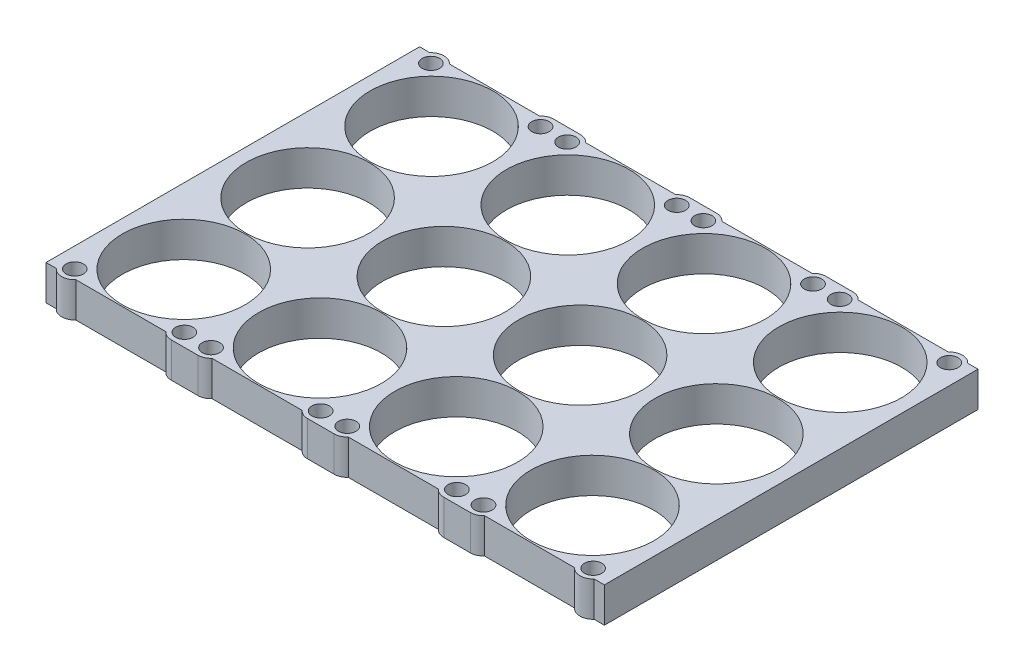
from build123d import *

# Parameters (mm, degrees)
SKETCH1_W           = 127.76
SKETCH1_H           = 85.48
SKETCH1_R           = 14.05
BOSS_EXTRUDE3_DEPTH = 8
BOSS_EXTRUDE4_DEPTH = 8
SKETCH4_R           = 1.1
CUT_EXTRUDE2_DEPTH  = 10
CUT_EXTRUDE3_START  = 8
SKETCH7_R           = 2
CUT_EXTRUDE3_DEPTH  = 3


with BuildPart() as part:
    # Sketch1 → Boss-Extrude3 (new body)
    with BuildSketch(Plane(origin=(0, 0, 0), x_dir=(1, 0, 0), z_dir=(0, 1, 0))):
        with Locations((63.88, -42.74)):
            Rectangle(SKETCH1_W, SKETCH1_H)
        with Locations(Location((17.122, -71.085, 0), (0, 0, 270))):
            Circle(SKETCH1_R, mode=Mode.SUBTRACT)
        with Locations(Location((17.122, -42.74, 0), (0, 0, 270))):
            Circle(SKETCH1_R, mode=Mode.SUBTRACT)
        with Locations(Location((110.638, -71.085, 0), (0, 0, 270))):
            Circle(SKETCH1_R, mode=Mode.SUBTRACT)
        with Locations(Location((79.466, -71.085, 0), (0, 0, 270))):
            Circle(SKETCH1_R, mode=Mode.SUBTRACT)
        with Locations(Location((48.294, -71.085, 0), (0, 0, 270))):
            Circle(SKETCH1_R, mode=Mode.SUBTRACT)
        with Locations(Location((110.638, -42.74, 0), (0, 0, 270))):
            Circle(SKETCH1_R, mode=Mode.SUBTRACT)
        with Locations(Location((79.466, -42.74, 0), (0, 0, 270))):
            Circle(SKETCH1_R, mode=Mode.SUBTRACT)
        with Locations(Location((48.294, -42.74, 0), (0, 0, 270))):
            Circle(SKETCH1_R, mode=Mode.SUBTRACT)
        with Locations(Location((110.638, -14.395, 0), (0, 0, 270))):
            Circle(SKETCH1_R, mode=Mode.SUBTRACT)
        with Locations(Location((79.466, -14.395, 0), (0, 0, 270))):
            Circle(SKETCH1_R, mode=Mode.SUBTRACT)
        with Locations(Location((48.294, -14.395, 0), (0, 0, 270))):
            Circle(SKETCH1_R, mode=Mode.SUBTRACT)
        with Locations(Location((17.122, -14.395, 0), (0, 0, 270))):
            Circle(SKETCH1_R, mode=Mode.SUBTRACT)
    extrude(amount=BOSS_EXTRUDE3_DEPTH)

    # Sketch2 → Boss-Extrude4 (add)
    with BuildSketch(Plane.XZ):
        with BuildLine():
            ThreePointArc((2.345932023, 0), (4.582, -1), (6.818067977, 0))
            Line((6.818067977, 0), (2.345932023, 0))
        make_face()
        with BuildLine():
            Line((2.345932023, 0), (6.818067977, 0))
            ThreePointArc((6.818067977, 0), (7.384517077, 0.929533731), (7.582, 2))
            ThreePointArc((7.582, 2), (3.511533731, 4.802517077), (2.345932023, 0))
        make_face()
        with BuildLine():
            ThreePointArc((32.662, 2), (31.783320344, 4.121320344), (29.662, 5))
            Line((29.662, 5), (29.662, 0))
            Line((29.662, 0), (31.898067977, 0))
            ThreePointArc((31.898067977, 0), (32.464517077, 0.929533731), (32.662, 2))
        make_face()
        with BuildLine():
            Line((29.662, 0), (29.662, 5))
            ThreePointArc((29.662, 5), (26.923387212, 3.224744871), (27.425932023, 0))
            Line((27.425932023, 0), (29.662, 0))
        make_face()
        with BuildLine():
            Line((31.898067977, 0), (29.662, 0))
            Line((29.662, 0), (29.662, -1))
            ThreePointArc((29.662, -1), (30.886744871, -0.738612788), (31.898067977, 0))
        make_face()
        with BuildLine():
            Line((29.662, -1), (29.662, 0))
            Line((29.662, 0), (27.425932023, 0))
            ThreePointArc((27.425932023, 0), (28.437255129, -0.738612788), (29.662, -1))
        make_face()
        with BuildLine():
            ThreePointArc((35.754, -1), (34.529255129, -0.738612788), (33.517932023, 0))
            Line((33.517932023, 0), (31.898067977, 0))
            ThreePointArc((31.898067977, 0), (30.886744871, -0.738612788), (29.662, -1))
            Line((29.662, -1), (35.754, -1))
        make_face()
        with BuildLine():
            ThreePointArc((38.754, 2), (37.875320344, 4.121320344), (35.754, 5))
            Line((35.754, 5), (35.754, 0))
            Line((35.754, 0), (37.990067977, 0))
            ThreePointArc((37.990067977, 0), (38.556517077, 0.929533731), (38.754, 2))
        make_face()
        with BuildLine():
            Line((35.754, 0), (35.754, 5))
            ThreePointArc((35.754, 5), (33.015387212, 3.224744871), (33.517932023, 0))
            Line((33.517932023, 0), (35.754, 0))
        make_face()
        with BuildLine():
            Line((37.990067977, 0), (35.754, 0))
            Line((35.754, 0), (35.754, -1))
            ThreePointArc((35.754, -1), (36.978744871, -0.738612788), (37.990067977, 0))
        make_face()
        with BuildLine():
            Line((35.754, -1), (35.754, 0))
            Line((35.754, 0), (33.517932023, 0))
            ThreePointArc((33.517932023, 0), (34.529255129, -0.738612788), (35.754, -1))
        make_face()
        with BuildLine():
            ThreePointArc((60.834, 5), (58.095387212, 3.224744871), (58.597932023, 0))
            Line((58.597932023, 0), (60.834, 0))
            Line((60.834, 0), (60.834, 5))
        make_face()
        with BuildLine():
            Line((60.834, 0), (58.597932023, 0))
            ThreePointArc((58.597932023, 0), (59.609255129, -0.738612788), (60.834, -1))
            Line((60.834, -1), (60.834, 0))
        make_face()
        with BuildLine():
            ThreePointArc((63.834, 2), (62.955320344, 4.121320344), (60.834, 5))
            Line((60.834, 5), (60.834, 0))
            Line((60.834, 0), (63.070067977, 0))
            ThreePointArc((63.070067977, 0), (63.636517077, 0.929533731), (63.834, 2))
        make_face()
        with BuildLine():
            Line((60.834, 0), (60.834, -1))
            ThreePointArc((60.834, -1), (62.058744871, -0.738612788), (63.070067977, 0))
            Line((63.070067977, 0), (60.834, 0))
        make_face()
        with BuildLine():
            ThreePointArc((63.070067977, 0), (62.058744871, -0.738612788), (60.834, -1))
            Line((60.834, -1), (66.926, -1))
            ThreePointArc((66.926, -1), (65.701255129, -0.738612788), (64.689932023, 0))
            Line((64.689932023, 0), (63.070067977, 0))
        make_face()
        with BuildLine():
            ThreePointArc((69.926, 2), (69.047320344, 4.121320344), (66.926, 5))
            Line((66.926, 5), (66.926, 0))
            Line((66.926, 0), (69.162067977, 0))
            ThreePointArc((69.162067977, 0), (69.728517077, 0.929533731), (69.926, 2))
        make_face()
        with BuildLine():
            Line((66.926, 0), (66.926, 5))
            ThreePointArc((66.926, 5), (64.187387212, 3.224744871), (64.689932023, 0))
            Line((64.689932023, 0), (66.926, 0))
        make_face()
        with BuildLine():
            ThreePointArc((64.689932023, 0), (65.701255129, -0.738612788), (66.926, -1))
            Line((66.926, -1), (66.926, 0))
            Line((66.926, 0), (64.689932023, 0))
        make_face()
        with BuildLine():
            Line((66.926, 0), (66.926, -1))
            ThreePointArc((66.926, -1), (68.150744871, -0.738612788), (69.162067977, 0))
            Line((69.162067977, 0), (66.926, 0))
        make_face()
        with BuildLine():
            ThreePointArc((92.006, 5), (89.267387212, 3.224744871), (89.769932023, 0))
            Line((89.769932023, 0), (92.006, 0))
            Line((92.006, 0), (92.006, 5))
        make_face()
        with BuildLine():
            Line((92.006, 0), (89.769932023, 0))
            ThreePointArc((89.769932023, 0), (90.781255129, -0.738612788), (92.006, -1))
            Line((92.006, -1), (92.006, 0))
        make_face()
        with BuildLine():
            ThreePointArc((95.006, 2), (94.127320344, 4.121320344), (92.006, 5))
            Line((92.006, 5), (92.006, 0))
            Line((92.006, 0), (94.242067977, 0))
            ThreePointArc((94.242067977, 0), (94.808517077, 0.929533731), (95.006, 2))
        make_face()
        with BuildLine():
            Line((92.006, 0), (92.006, -1))
            ThreePointArc((92.006, -1), (93.230744871, -0.738612788), (94.242067977, 0))
            Line((94.242067977, 0), (92.006, 0))
        make_face()
        with BuildLine():
            ThreePointArc((94.242067977, 0), (93.230744871, -0.738612788), (92.006, -1))
            Line((92.006, -1), (98.098, -1))
            ThreePointArc((98.098, -1), (96.873255129, -0.738612788), (95.861932023, 0))
            Line((95.861932023, 0), (94.242067977, 0))
        make_face()
        with BuildLine():
            ThreePointArc((101.098, 2), (100.219320344, 4.121320344), (98.098, 5))
            Line((98.098, 5), (98.098, 0))
            Line((98.098, 0), (100.334067977, 0))
            ThreePointArc((100.334067977, 0), (100.900517077, 0.929533731), (101.098, 2))
        make_face()
        with BuildLine():
            Line((98.098, 0), (98.098, 5))
            ThreePointArc((98.098, 5), (95.359387212, 3.224744871), (95.861932023, 0))
            Line((95.861932023, 0), (98.098, 0))
        make_face()
        with BuildLine():
            ThreePointArc((95.861932023, 0), (96.873255129, -0.738612788), (98.098, -1))
            Line((98.098, -1), (98.098, 0))
            Line((98.098, 0), (95.861932023, 0))
        make_face()
        with BuildLine():
            Line((98.098, 0), (98.098, -1))
            ThreePointArc((98.098, -1), (99.322744871, -0.738612788), (100.334067977, 0))
            Line((100.334067977, 0), (98.098, 0))
        make_face()
        with BuildLine():
            ThreePointArc((126.178, 2), (122.107533731, 4.802517077), (120.941932023, 0))
            Line((120.941932023, 0), (125.414067977, 0))
            ThreePointArc((125.414067977, 0), (125.980517077, 0.929533731), (126.178, 2))
        make_face()
        with BuildLine():
            Line((125.414067977, 0), (120.941932023, 0))
            ThreePointArc((120.941932023, 0), (123.178, -1), (125.414067977, 0))
        make_face()
        with BuildLine():
            ThreePointArc((125.414067977, 85.48), (123.178, 86.48), (120.941932023, 85.48))
            Line((120.941932023, 85.48), (125.414067977, 85.48))
        make_face()
        with BuildLine():
            Line((125.414067977, 85.48), (120.941932023, 85.48))
            ThreePointArc((120.941932023, 85.48), (122.107533731, 80.677482923), (126.178, 83.48))
            ThreePointArc((126.178, 83.48), (125.980517077, 84.550466269), (125.414067977, 85.48))
        make_face()
        with BuildLine():
            ThreePointArc((100.334067977, 85.48), (99.322744871, 86.218612788), (98.098, 86.48))
            Line((98.098, 86.48), (98.098, 85.48))
            Line((98.098, 85.48), (100.334067977, 85.48))
        make_face()
        with BuildLine():
            Line((98.098, 85.48), (98.098, 86.48))
            ThreePointArc((98.098, 86.48), (96.873255129, 86.218612788), (95.861932023, 85.48))
            Line((95.861932023, 85.48), (98.098, 85.48))
        make_face()
        with BuildLine():
            Line((100.334067977, 85.48), (98.098, 85.48))
            Line((98.098, 85.48), (98.098, 80.48))
            ThreePointArc((98.098, 80.48), (100.219320344, 81.358679656), (101.098, 83.48))
            ThreePointArc((101.098, 83.48), (100.900517077, 84.550466269), (100.334067977, 85.48))
        make_face()
        with BuildLine():
            Line((98.098, 80.48), (98.098, 85.48))
            Line((98.098, 85.48), (95.861932023, 85.48))
            ThreePointArc((95.861932023, 85.48), (95.359387212, 82.255255129), (98.098, 80.48))
        make_face()
        with BuildLine():
            Line((98.098, 86.48), (92.006, 86.48))
            ThreePointArc((92.006, 86.48), (93.230744871, 86.218612788), (94.242067977, 85.48))
            Line((94.242067977, 85.48), (95.861932023, 85.48))
            ThreePointArc((95.861932023, 85.48), (96.873255129, 86.218612788), (98.098, 86.48))
        make_face()
        with BuildLine():
            ThreePointArc((94.242067977, 85.48), (93.230744871, 86.218612788), (92.006, 86.48))
            Line((92.006, 86.48), (92.006, 85.48))
            Line((92.006, 85.48), (94.242067977, 85.48))
        make_face()
        with BuildLine():
            Line((92.006, 85.48), (92.006, 86.48))
            ThreePointArc((92.006, 86.48), (90.781255129, 86.218612788), (89.769932023, 85.48))
            Line((89.769932023, 85.48), (92.006, 85.48))
        make_face()
        with BuildLine():
            Line((94.242067977, 85.48), (92.006, 85.48))
            Line((92.006, 85.48), (92.006, 80.48))
            ThreePointArc((92.006, 80.48), (94.127320344, 81.358679656), (95.006, 83.48))
            ThreePointArc((95.006, 83.48), (94.808517077, 84.550466269), (94.242067977, 85.48))
        make_face()
        with BuildLine():
            Line((92.006, 80.48), (92.006, 85.48))
            Line((92.006, 85.48), (89.769932023, 85.48))
            ThreePointArc((89.769932023, 85.48), (89.267387212, 82.255255129), (92.006, 80.48))
        make_face()
        with BuildLine():
            ThreePointArc((69.926, 83.48), (69.728517077, 84.550466269), (69.162067977, 85.48))
            Line((69.162067977, 85.48), (66.926, 85.48))
            Line((66.926, 85.48), (66.926, 80.48))
            ThreePointArc((66.926, 80.48), (69.047320344, 81.358679656), (69.926, 83.48))
        make_face()
        with BuildLine():
            Line((66.926, 85.48), (69.162067977, 85.48))
            ThreePointArc((69.162067977, 85.48), (68.150744871, 86.218612788), (66.926, 86.48))
            Line((66.926, 86.48), (66.926, 85.48))
        make_face()
        with BuildLine():
            Line((66.926, 85.48), (66.926, 86.48))
            ThreePointArc((66.926, 86.48), (65.701255129, 86.218612788), (64.689932023, 85.48))
            Line((64.689932023, 85.48), (66.926, 85.48))
        make_face()
        with BuildLine():
            Line((66.926, 80.48), (66.926, 85.48))
            Line((66.926, 85.48), (64.689932023, 85.48))
            ThreePointArc((64.689932023, 85.48), (64.187387212, 82.255255129), (66.926, 80.48))
        make_face()
        with BuildLine():
            ThreePointArc((64.689932023, 85.48), (65.701255129, 86.218612788), (66.926, 86.48))
            Line((66.926, 86.48), (60.834, 86.48))
            ThreePointArc((60.834, 86.48), (62.058744871, 86.218612788), (63.070067977, 85.48))
            Line((63.070067977, 85.48), (64.689932023, 85.48))
        make_face()
        with BuildLine():
            ThreePointArc((63.070067977, 85.48), (62.058744871, 86.218612788), (60.834, 86.48))
            Line((60.834, 86.48), (60.834, 85.48))
            Line((60.834, 85.48), (63.070067977, 85.48))
        make_face()
        with BuildLine():
            Line((60.834, 85.48), (60.834, 86.48))
            ThreePointArc((60.834, 86.48), (59.609255129, 86.218612788), (58.597932023, 85.48))
            Line((58.597932023, 85.48), (60.834, 85.48))
        make_face()
        with BuildLine():
            ThreePointArc((58.597932023, 85.48), (58.095387212, 82.255255129), (60.834, 80.48))
            Line((60.834, 80.48), (60.834, 85.48))
            Line((60.834, 85.48), (58.597932023, 85.48))
        make_face()
        with BuildLine():
            Line((60.834, 85.48), (60.834, 80.48))
            ThreePointArc((60.834, 80.48), (62.955320344, 81.358679656), (63.834, 83.48))
            ThreePointArc((63.834, 83.48), (63.636517077, 84.550466269), (63.070067977, 85.48))
            Line((63.070067977, 85.48), (60.834, 85.48))
        make_face()
        with BuildLine():
            ThreePointArc((7.582, 83.48), (7.384517077, 84.550466269), (6.818067977, 85.48))
            Line((6.818067977, 85.48), (2.345932023, 85.48))
            ThreePointArc((2.345932023, 85.48), (3.511533731, 80.677482923), (7.582, 83.48))
        make_face()
        with BuildLine():
            Line((2.345932023, 85.48), (6.818067977, 85.48))
            ThreePointArc((6.818067977, 85.48), (4.582, 86.48), (2.345932023, 85.48))
        make_face()
        with BuildLine():
            ThreePointArc((31.898067977, 85.48), (30.886744871, 86.218612788), (29.662, 86.48))
            Line((29.662, 86.48), (29.662, 85.48))
            Line((29.662, 85.48), (31.898067977, 85.48))
        make_face()
        with BuildLine():
            Line((29.662, 85.48), (29.662, 86.48))
            ThreePointArc((29.662, 86.48), (28.437255129, 86.218612788), (27.425932023, 85.48))
            Line((27.425932023, 85.48), (29.662, 85.48))
        make_face()
        with BuildLine():
            ThreePointArc((27.425932023, 85.48), (26.923387212, 82.255255129), (29.662, 80.48))
            Line((29.662, 80.48), (29.662, 85.48))
            Line((29.662, 85.48), (27.425932023, 85.48))
        make_face()
        with BuildLine():
            Line((29.662, 85.48), (29.662, 80.48))
            ThreePointArc((29.662, 80.48), (31.783320344, 81.358679656), (32.662, 83.48))
            ThreePointArc((32.662, 83.48), (32.464517077, 84.550466269), (31.898067977, 85.48))
            Line((31.898067977, 85.48), (29.662, 85.48))
        make_face()
        with BuildLine():
            ThreePointArc((33.517932023, 85.48), (34.529255129, 86.218612788), (35.754, 86.48))
            Line((35.754, 86.48), (29.662, 86.48))
            ThreePointArc((29.662, 86.48), (30.886744871, 86.218612788), (31.898067977, 85.48))
            Line((31.898067977, 85.48), (33.517932023, 85.48))
        make_face()
        with BuildLine():
            ThreePointArc((38.754, 83.48), (38.556517077, 84.550466269), (37.990067977, 85.48))
            Line((37.990067977, 85.48), (35.754, 85.48))
            Line((35.754, 85.48), (35.754, 80.48))
            ThreePointArc((35.754, 80.48), (37.875320344, 81.358679656), (38.754, 83.48))
        make_face()
        with BuildLine():
            Line((35.754, 85.48), (37.990067977, 85.48))
            ThreePointArc((37.990067977, 85.48), (36.978744871, 86.218612788), (35.754, 86.48))
            Line((35.754, 86.48), (35.754, 85.48))
        make_face()
        with BuildLine():
            Line((35.754, 85.48), (35.754, 86.48))
            ThreePointArc((35.754, 86.48), (34.529255129, 86.218612788), (33.517932023, 85.48))
            Line((33.517932023, 85.48), (35.754, 85.48))
        make_face()
        with BuildLine():
            Line((35.754, 80.48), (35.754, 85.48))
            Line((35.754, 85.48), (33.517932023, 85.48))
            ThreePointArc((33.517932023, 85.48), (33.015387212, 82.255255129), (35.754, 80.48))
        make_face()
    extrude(amount=-BOSS_EXTRUDE4_DEPTH)

    # Sketch4 → Cut-Extrude2 (cut)
    with BuildSketch(Plane(origin=(0, 8, 0), x_dir=(1, 0, 0), z_dir=(0, 1, 0))):
        with Locations(Location((4.582, -83.48, 0), (0, 0, 270))):
            Circle(SKETCH4_R)
        with Locations(Location((29.662, -83.48, 0), (0, 0, 270))):
            Circle(SKETCH4_R)
        with Locations(Location((29.662, -2, 0), (0, 0, 270))):
            Circle(SKETCH4_R)
        with Locations(Location((4.582, -2, 0), (0, 0, 270))):
            Circle(SKETCH4_R)
        with Locations(Location((35.754, -83.48, 0), (0, 0, 270))):
            Circle(SKETCH4_R)
        with Locations(Location((60.834, -83.48, 0), (0, 0, 270))):
            Circle(SKETCH4_R)
        with Locations(Location((60.834, -2, 0), (0, 0, 270))):
            Circle(SKETCH4_R)
        with Locations(Location((35.754, -2, 0), (0, 0, 270))):
            Circle(SKETCH4_R)
        with Locations(Location((66.926, -83.48, 0), (0, 0, 270))):
            Circle(SKETCH4_R)
        with Locations(Location((92.006, -83.48, 0), (0, 0, 270))):
            Circle(SKETCH4_R)
        with Locations(Location((92.006, -2, 0), (0, 0, 270))):
            Circle(SKETCH4_R)
        with Locations(Location((66.926, -2, 0), (0, 0, 270))):
            Circle(SKETCH4_R)
        with Locations(Location((98.098, -83.48, 0), (0, 0, 270))):
            Circle(SKETCH4_R)
        with Locations(Location((123.178, -83.48, 0), (0, 0, 270))):
            Circle(SKETCH4_R)
        with Locations(Location((123.178, -2, 0), (0, 0, 270))):
            Circle(SKETCH4_R)
        with Locations(Location((98.098, -2, 0), (0, 0, 270))):
            Circle(SKETCH4_R)
    extrude(amount=-CUT_EXTRUDE2_DEPTH, mode=Mode.SUBTRACT)

    # Sketch7 → Cut-Extrude3 (cut)
    with BuildSketch(Plane(origin=(0, 0, 0), x_dir=(1, 0, 0), z_dir=(0, 1, 0)).offset(CUT_EXTRUDE3_START)):
        with Locations(Location((4.582, -83.48, 0), (0, 0, 270))):
            Circle(SKETCH7_R)
        with Locations(Location((29.662, -83.48, 0), (0, 0, 270))):
            Circle(SKETCH7_R)
        with Locations(Location((29.662, -2, 0), (0, 0, 270))):
            Circle(SKETCH7_R)
        with Locations(Location((4.582, -2, 0), (0, 0, 270))):
            Circle(SKETCH7_R)
        with Locations(Location((35.754, -83.48, 0), (0, 0, 270))):
            Circle(SKETCH7_R)
        with Locations(Location((60.834, -83.48, 0), (0, 0, 270))):
            Circle(SKETCH7_R)
        with Locations(Location((60.834, -2, 0), (0, 0, 270))):
            Circle(SKETCH7_R)
        with Locations(Location((35.754, -2, 0), (0, 0, 270))):
            Circle(SKETCH7_R)
        with Locations(Location((66.926, -83.48, 0), (0, 0, 270))):
            Circle(SKETCH7_R)
        with Locations(Location((92.006, -83.48, 0), (0, 0, 270))):
            Circle(SKETCH7_R)
        with Locations(Location((92.006, -2, 0), (0, 0, 270))):
            Circle(SKETCH7_R)
        with Locations(Location((66.926, -2, 0), (0, 0, 270))):
            Circle(SKETCH7_R)
        with Locations(Location((98.098, -83.48, 0), (0, 0, 270))):
            Circle(SKETCH7_R)
        with Locations(Location((123.178, -83.48, 0), (0, 0, 270))):
            Circle(SKETCH7_R)
        with Locations(Location((123.178, -2, 0), (0, 0, 270))):
            Circle(SKETCH7_R)
        with Locations(Location((98.098, -2, 0), (0, 0, 270))):
            Circle(SKETCH7_R)
    extrude(amount=-CUT_EXTRUDE3_DEPTH, mode=Mode.SUBTRACT)


solid = part.part
